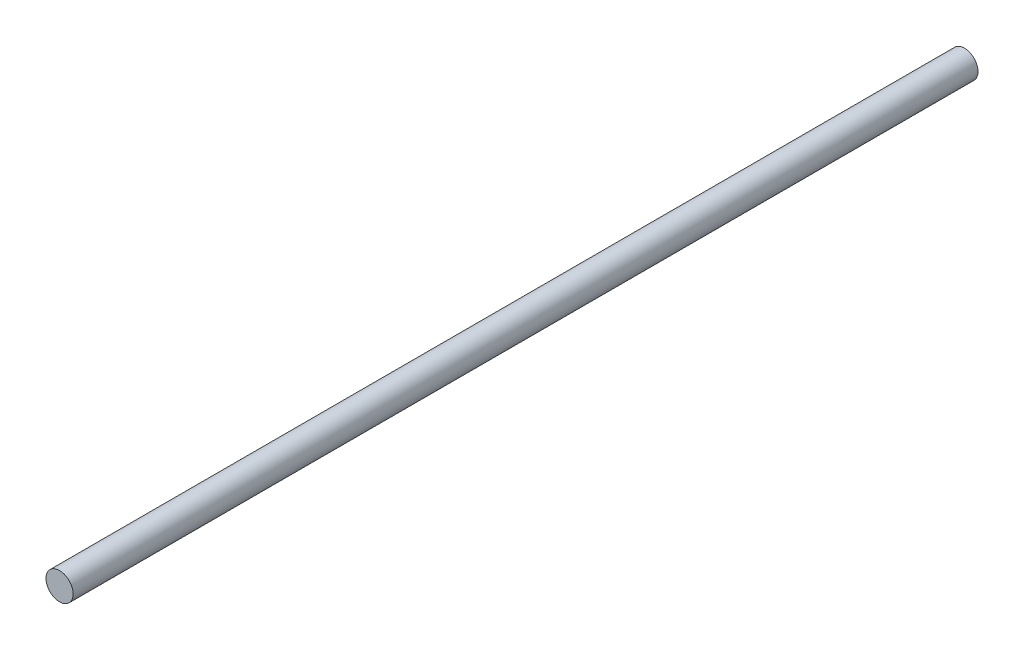
from build123d import *

# Parameters (mm, degrees)
SCHIZZO1_R                   = 1.5
ESTRUSIONE_ESTRUSIONE1_DEPTH = 100


with BuildPart() as part:
    # Schizzo1 → Estrusione-Estrusione1 (new body)
    with BuildSketch(Plane.XY):
        Circle(SCHIZZO1_R)
    extrude(amount=ESTRUSIONE_ESTRUSIONE1_DEPTH)


solid = part.part
